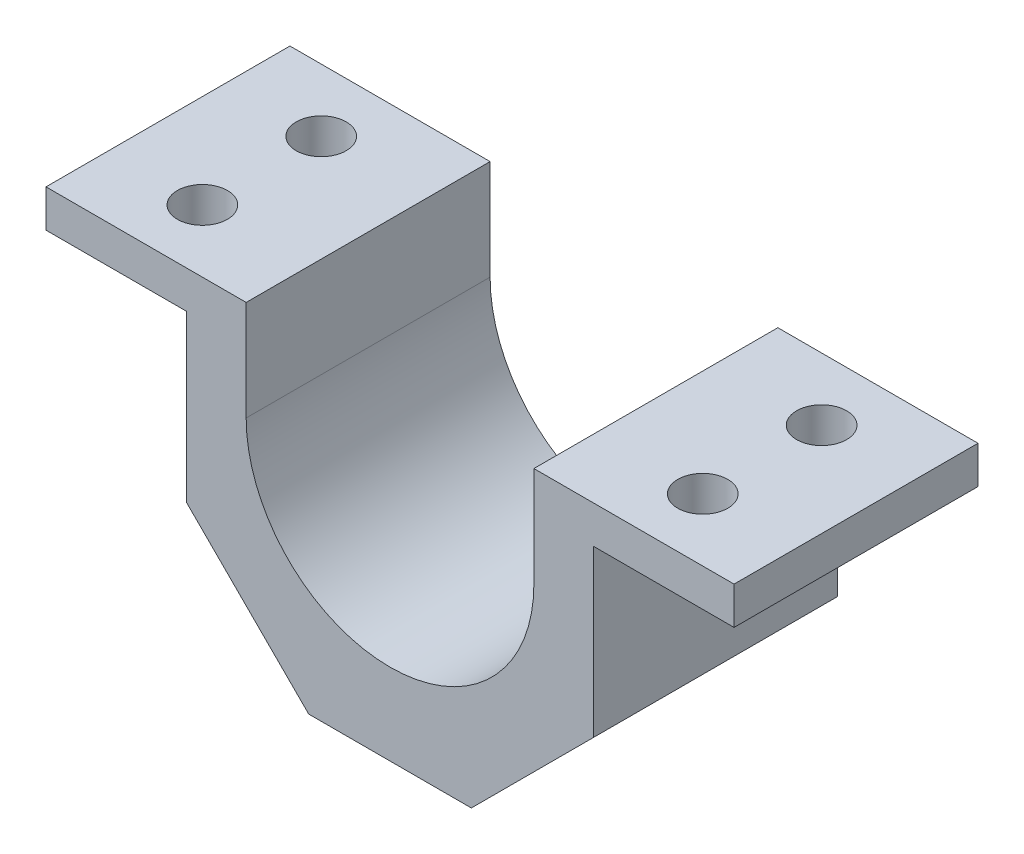
from build123d import *

# Parameters (mm, degrees)
BOSS_EXTRUDE2_DEPTH = 19.5
SKETCH3_R           = 4
CUT_EXTRUDE2_DEPTH  = 20


with BuildPart() as part:
    # Sketch1 → Boss-Extrude2 (new, symmetric)
    with BuildSketch(Plane.XY):
        with BuildLine():
            Line((-23, 16), (-55, 16))
            Line((-55, 16), (-55, 10))
            Line((-55, 10), (-32.5, 10))
            Line((-32.5, 10), (-32.5, -16.5))
            Line((-32.5, -16.5), (-13, -36))
            Line((-13, -36), (13, -36))
            Line((13, -36), (32.5, -16.5))
            Line((32.5, -16.5), (32.5, 10))
            Line((32.5, 10), (55, 10))
            Line((55, 10), (55, 16))
            Line((55, 16), (23, 16))
            Line((23, 16), (23, 0))
            ThreePointArc((23, 0), (0, -23), (-23, 0))
            Line((-23, 0), (-23, 16))
        make_face()
    extrude(amount=BOSS_EXTRUDE2_DEPTH, both=True)

    # Sketch3 → Cut-Extrude2 (cut)
    with BuildSketch(Plane(origin=(0, 16, 0), x_dir=(1, 0, 0), z_dir=(0, 1, 0))):
        with Locations(Location((40, 9.5, 0), (0, 0, 180))):
            Circle(SKETCH3_R)
        with Locations(Location((-40, 9.5, 0), (0, 0, 180))):
            Circle(SKETCH3_R)
        with Locations(Location((40, -9.5, 0), (0, 0, 180))):
            Circle(SKETCH3_R)
        with Locations(Location((-40, -9.5, 0), (0, 0, 180))):
            Circle(SKETCH3_R)
    extrude(amount=-CUT_EXTRUDE2_DEPTH, mode=Mode.SUBTRACT)


solid = part.part
